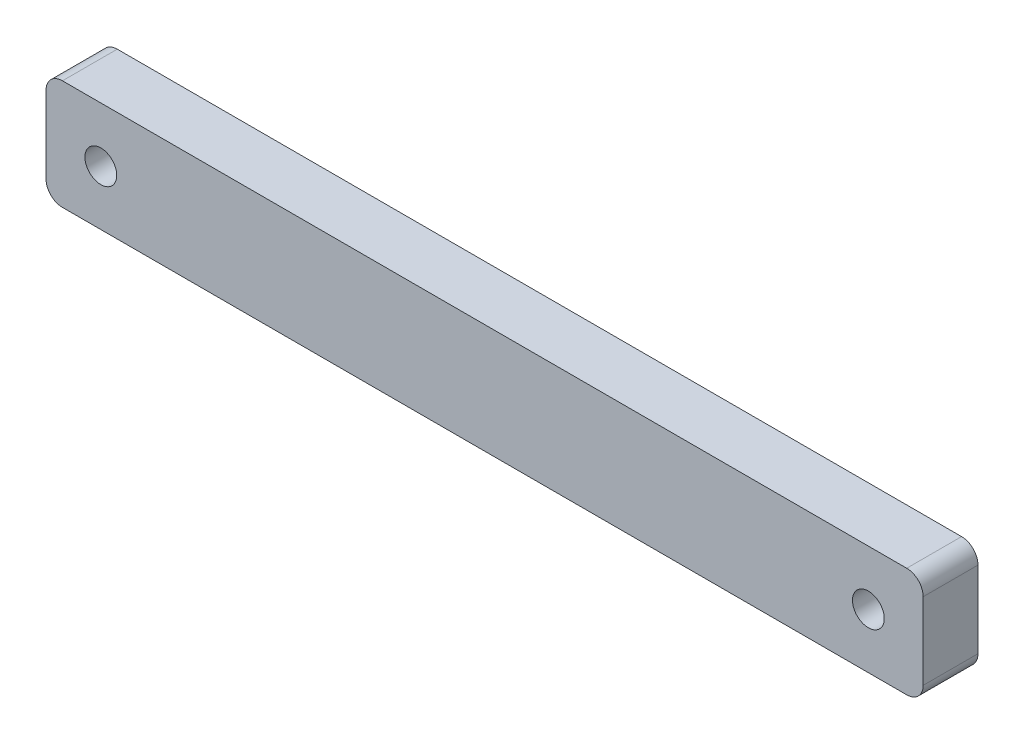
from build123d import *

# Parameters (mm, degrees)
SKETCH1_R           = 3.683
BOSS_EXTRUDE1_DEPTH = 12.7
SKETCH2_R           = 3.683
BOSS_EXTRUDE2_DEPTH = 6.35


with BuildPart() as part:
    # Sketch1 → Boss-Extrude1 (new body)
    with BuildSketch(Plane.XY):
        with BuildLine():
            Line((97.79, -12.7), (-97.79, -12.7))
            ThreePointArc((-97.79, -12.7), (-100.484076836, -11.584076836), (-101.6, -8.89))
            Line((-101.6, -8.89), (-101.6, 8.89))
            ThreePointArc((-101.6, 8.89), (-100.484076836, 11.584076836), (-97.79, 12.7))
            Line((-97.79, 12.7), (97.79, 12.7))
            ThreePointArc((97.79, 12.7), (100.484076836, 11.584076836), (101.6, 8.89))
            Line((101.6, 8.89), (101.6, -8.89))
            ThreePointArc((101.6, -8.89), (100.484076836, -11.584076836), (97.79, -12.7))
        make_face()
        with Locations((-88.9, 0)):
            Circle(SKETCH1_R, mode=Mode.SUBTRACT)
        with Locations((88.9, 0)):
            Circle(SKETCH1_R, mode=Mode.SUBTRACT)
    extrude(amount=BOSS_EXTRUDE1_DEPTH)

    # Sketch2 → Boss-Extrude2 (add)
    with BuildSketch(Plane(origin=(0, 0, 0), x_dir=(-1, 0, 0), z_dir=(0, 0, -1))):
        with Locations((-88.9, 0)):
            Circle(SKETCH2_R)
        with Locations((88.9, 0)):
            Circle(SKETCH2_R)
    extrude(amount=-BOSS_EXTRUDE2_DEPTH)


solid = part.part
